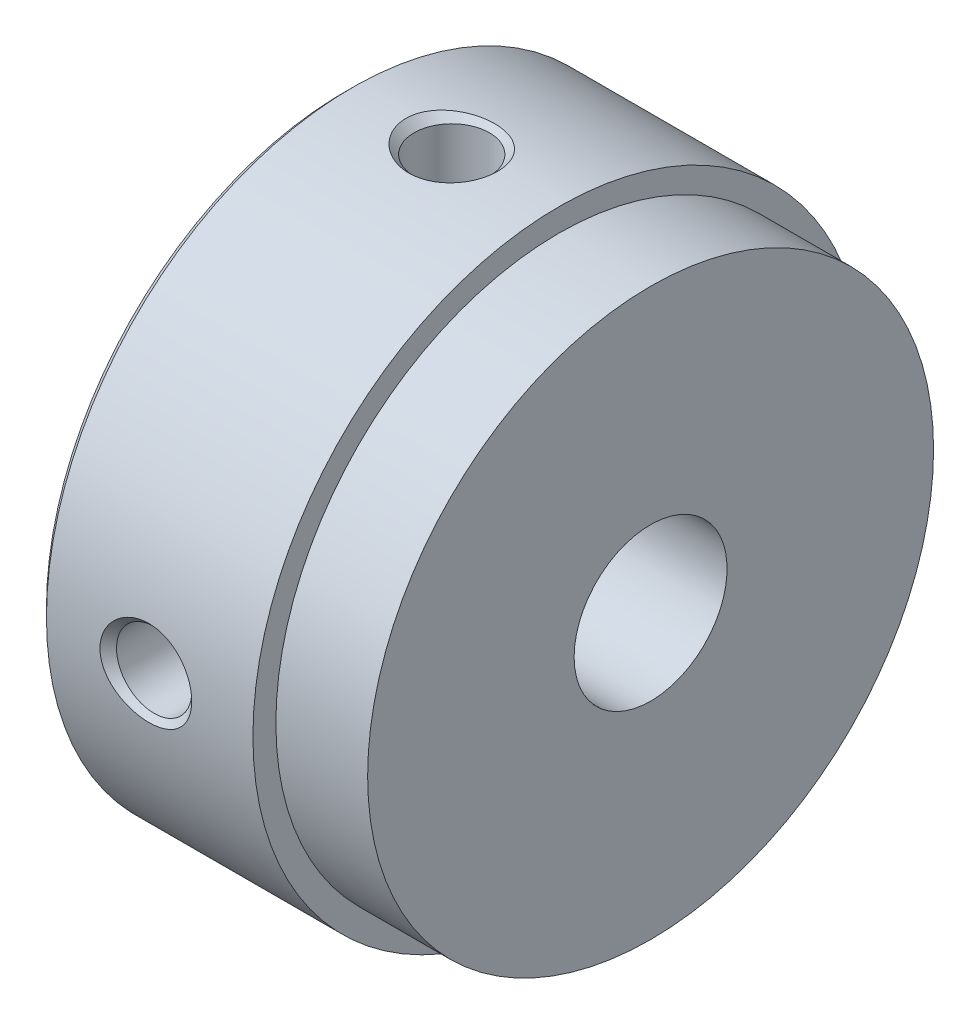
from build123d import *


with BuildPart() as part:
    # Sketch1 → Revolve1 (revolve)
    with BuildSketch(Plane.XY, mode=Mode.PRIVATE) as revolve1_sk:
        Polygon((0, 9.75), (0, 2.5), (10, 2.5), (10, 9.25), (7, 9.25), (7, 10), (0.25, 10), align=None)
    revolve(revolve1_sk.sketch.rotate(Axis((10, 0, 0), (-1, 0, 0)), 270), axis=Axis((10, 0, 0), (-1, 0, 0)))

    # Sketch2 → Cut-Revolve1 (revolve, cut)
    with BuildSketch(Plane(origin=(3.5, 0, 0), x_dir=(0, 0, -1), z_dir=(1, 0, 0)), mode=Mode.PRIVATE) as cut_revolve1_sk:
        Polygon((0, 10), (1.5, 10), (1.2295, 9.7295), (1.2295, 0), (0, 0), align=None)
    revolve(cut_revolve1_sk.sketch.rotate(Axis((3.5, 0, 0), (0, 1, 0)), 180), axis=Axis((3.5, 0, 0), (0, 1, 0)), mode=Mode.SUBTRACT)

    # Sketch3 → Cut-Revolve2 (revolve, cut)
    with BuildSketch(Plane(origin=(3.5, 0, 0), x_dir=(0, 0, -1), z_dir=(1, 0, 0)), mode=Mode.PRIVATE) as cut_revolve2_sk:
        Polygon((-10, 0), (-10, 1.5), (-9.7295, 1.2295), (0, 1.2295), (0, 0), align=None)
    revolve(cut_revolve2_sk.sketch.rotate(Axis((3.5, 0, 0), (0, 0, 1)), 180), axis=Axis((3.5, 0, 0), (0, 0, 1)), mode=Mode.SUBTRACT)


solid = part.part
